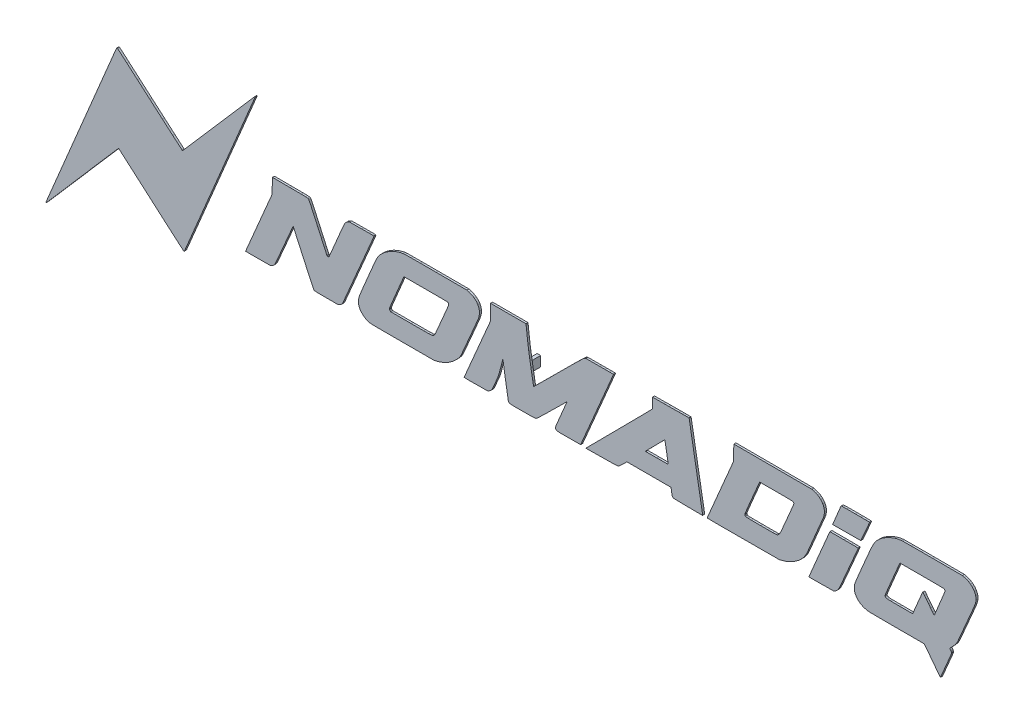
from build123d import *

# Parameters (mm, degrees)
Y_KSEKLIK_EKSTR_ZYON1_DEPTH   = 0.2
Y_KSEKLIK_EKSTR_ZYON1_2_DEPTH = 0.2
Y_KSEKLIK_EKSTR_ZYON1_3_DEPTH = 0.2
Y_KSEKLIK_EKSTR_ZYON1_4_DEPTH = 0.2
Y_KSEKLIK_EKSTR_ZYON1_5_DEPTH = 0.2
Y_KSEKLIK_EKSTR_ZYON1_6_DEPTH = 0.2
Y_KSEKLIK_EKSTR_ZYON1_7_DEPTH = 0.2
Y_KSEKLIK_EKSTR_ZYON1_8_DEPTH = 0.2
Y_KSEKLIK_EKSTR_ZYON1_9_DEPTH = 0.2
SKETCH4_W                     = 0.347706158
SKETCH4_H                     = 0.98459693
BOSS_EXTRUDE2_DEPTH           = 1


with BuildPart() as part:
    # Çizim1 → Yükseklik-Ekstrüzyon1 (new body)
    with BuildSketch(Plane.XY):
        with BuildLine():
            Line((-30.51702252, 5.640207004), (-31.881612062, 4.06777004))
            Line((-31.881612062, 4.06777004), (-33.036250842, 2.743929182))
            Line((-33.036250842, 2.743929182), (-34.080710724, 1.55031139))
            ThreePointArc((-34.080710724, 1.55031139), (-34.091671992, 1.542168784), (-34.10501822, 1.539282674))
            ThreePointArc((-34.10501822, 1.539282674), (-34.118726717, 1.541740246), (-34.130727781, 1.54880686))
            Line((-34.130727781, 1.54880686), (-35.069522655, 2.355004396))
            Line((-35.069522655, 2.355004396), (-36.109605746, 3.251459149))
            Line((-36.109605746, 3.251459149), (-37.338076284, 4.316207648))
            Line((-37.338076284, 4.316207648), (-38.566568336, 5.381941386))
            Line((-38.566568336, 5.381941386), (-39.606822395, 6.281527372))
            Line((-39.606822395, 6.281527372), (-40.544864829, 7.091037097))
            ThreePointArc((-40.544864829, 7.091037097), (-40.557629792, 7.100257414), (-40.571789719, 7.10714617))
            ThreePointArc((-40.571789719, 7.10714617), (-40.5829683, 7.1080489), (-40.592857954, 7.102760201))
            ThreePointArc((-40.592857954, 7.102760201), (-40.60694744, 7.08733319), (-40.619299402, 7.070482809))
            ThreePointArc((-40.619299402, 7.070482809), (-40.636141797, 7.042669784), (-40.651039165, 7.013768244))
            Line((-40.651039165, 7.013768244), (-40.690212238, 6.925912289))
            Line((-40.690212238, 6.925912289), (-42.278492498, 3.135697829))
            Line((-42.278492498, 3.135697829), (-44.770546021, -2.819218747))
            Line((-44.770546021, -2.819218747), (-47.603447582, -9.590605835))
            ThreePointArc((-47.603447582, -9.590605835), (-47.612762095, -9.614842221), (-47.620640209, -9.639582833))
            ThreePointArc((-47.620640209, -9.639582833), (-47.622682953, -9.648464643), (-47.623776393, -9.657512502))
            ThreePointArc((-47.623776393, -9.657512502), (-47.623612418, -9.665158958), (-47.622099978, -9.672656138))
            ThreePointArc((-47.622099978, -9.672656138), (-47.619722824, -9.678038864), (-47.616060206, -9.682644277))
            ThreePointArc((-47.616060206, -9.682644277), (-47.611784824, -9.685434425), (-47.606774081, -9.686412311))
            ThreePointArc((-47.606774081, -9.686412311), (-47.596603781, -9.684206995), (-47.588260373, -9.67798719))
            Line((-47.588260373, -9.67798719), (-46.540995922, -8.475870292))
            Line((-46.540995922, -8.475870292), (-45.384897882, -7.145566779))
            Line((-45.384897882, -7.145566779), (-44.016900278, -5.565418205))
            Line((-44.016900278, -5.565418205), (-42.649292697, -3.985259408))
            Line((-42.649292697, -3.985259408), (-41.494434005, -2.654966117))
            Line((-41.494434005, -2.654966117), (-40.447338079, -1.451149909))
            ThreePointArc((-40.447338079, -1.451149909), (-40.440685567, -1.446184753), (-40.432573306, -1.444424098))
            ThreePointArc((-40.432573306, -1.444424098), (-40.424232802, -1.445927767), (-40.416942521, -1.450249436))
            Line((-40.416942521, -1.450249436), (-39.470783162, -2.269237563))
            Line((-39.470783162, -2.269237563), (-38.425880059, -3.175657308))
            Line((-38.425880059, -3.175657308), (-37.188912139, -4.252299692))
            Line((-37.188912139, -4.252299692), (-35.600632388, -5.633848971))
            Line((-35.600632388, -5.633848971), (-34.660662613, -6.443124897))
            Line((-34.660662613, -6.443124897), (-33.971740802, -7.030480392))
            ThreePointArc((-33.971740802, -7.030480392), (-33.954050802, -7.036456708), (-33.937103258, -7.028618774))
            ThreePointArc((-33.937103258, -7.028618774), (-33.918071544, -7.004488567), (-33.903683781, -6.977332255))
            Line((-33.903683781, -6.977332255), (-30.415719601, 1.344084322))
            Line((-30.415719601, 1.344084322), (-26.926800707, 9.667966428))
            ThreePointArc((-26.926800707, 9.667966428), (-26.918578965, 9.694765841), (-26.915802041, 9.722660181))
            ThreePointArc((-26.915802041, 9.722660181), (-26.916283105, 9.726306898), (-26.91769339, 9.729704111))
            ThreePointArc((-26.91769339, 9.729704111), (-26.920050789, 9.732972259), (-26.923011854, 9.735705429))
            ThreePointArc((-26.923011854, 9.735705429), (-26.926812118, 9.738074074), (-26.930967674, 9.739742558))
            ThreePointArc((-26.930967674, 9.739742558), (-26.935605763, 9.740782255), (-26.94034612, 9.741131333))
            ThreePointArc((-26.94034612, 9.741131333), (-26.949504077, 9.739146935), (-26.957019216, 9.733549729))
            Line((-26.957019216, 9.733549729), (-28.001119252, 8.536484825))
            Line((-28.001119252, 8.536484825), (-29.153229053, 7.212664813))
            ThreePointArc((-29.153229053, 7.212664813), (-29.83537738, 6.426654115), (-30.51702252, 5.640207004))
        make_face()
    extrude(amount=Y_KSEKLIK_EKSTR_ZYON1_DEPTH)


with BuildPart() as body_2:
    # Çizim1 → Y_kseklik-Ekstr_zyon1 2 (new body)
    with BuildSketch(Plane.XY):
        with BuildLine():
            Line((34.002103981, 1.26593393), (33.401469652, -0.133194787))
            Line((33.401469652, -0.133194787), (33.068356265, -0.919046179))
            Line((33.068356265, -0.919046179), (32.780541835, -1.607236246))
            Line((32.780541835, -1.607236246), (32.536345399, -2.197879118))
            ThreePointArc((32.536345399, -2.197879118), (32.514730918, -2.255375588), (32.496752038, -2.314110499))
            ThreePointArc((32.496752038, -2.314110499), (32.475048302, -2.409792708), (32.46158888, -2.506978001))
            ThreePointArc((32.46158888, -2.506978001), (32.454335387, -2.617789021), (32.453635549, -2.728834983))
            ThreePointArc((32.453635549, -2.728834983), (32.45934273, -2.836087206), (32.471456413, -2.942805855))
            ThreePointArc((32.471456413, -2.942805855), (32.488615064, -3.027655366), (32.51524417, -3.110024958))
            ThreePointArc((32.51524417, -3.110024958), (32.598015349, -3.282399035), (32.706692791, -3.439730229))
            ThreePointArc((32.706692791, -3.439730229), (32.842536088, -3.584713762), (32.997270695, -3.709336501))
            ThreePointArc((32.997270695, -3.709336501), (33.178362317, -3.818649104), (33.37209352, -3.903570487))
            ThreePointArc((33.37209352, -3.903570487), (33.588460467, -3.96929215), (33.810587122, -4.011644735))
            ThreePointArc((33.810587122, -4.011644735), (33.899556978, -4.020972591), (33.988931573, -4.024823021))
            Line((33.988931573, -4.024823021), (34.653961876, -4.033038109))
            Line((34.653961876, -4.033038109), (35.528034198, -4.038897814))
            Line((35.528034198, -4.038897814), (36.700634893, -4.040997916))
            Line((36.700634893, -4.040997916), (39.381358713, -4.041881013))
            Line((39.381358713, -4.041881013), (40.168688525, -5.072515387))
            Line((40.168688525, -5.072515387), (40.471672307, -5.468355282))
            Line((40.471672307, -5.468355282), (40.729308349, -5.803224159))
            Line((40.729308349, -5.803224159), (40.960764599, -6.103025222))
            ThreePointArc((40.960764599, -6.103025222), (40.965728178, -6.108380079), (40.971569444, -6.112760857))
            ThreePointArc((40.971569444, -6.112760857), (40.980536493, -6.113867821), (40.987216734, -6.107784423))
            Line((40.987216734, -6.107784423), (41.525271591, -4.840033091))
            Line((41.525271591, -4.840033091), (42.037991789, -3.629832767))
            ThreePointArc((42.037991789, -3.629832767), (42.066806791, -3.554217315), (42.090091671, -3.476720121))
            ThreePointArc((42.090091671, -3.476720121), (42.091866692, -3.462041134), (42.089649173, -3.447422448))
            ThreePointArc((42.089649173, -3.447422448), (42.082221169, -3.425230658), (42.073172234, -3.403649008))
            ThreePointArc((42.073172234, -3.403649008), (42.059673501, -3.37676729), (42.044517758, -3.350783718))
            ThreePointArc((42.044517758, -3.350783718), (42.024882825, -3.320672342), (42.004149576, -3.291306409))
            Line((42.004149576, -3.291306409), (41.905031553, -3.15628061))
            Line((41.905031553, -3.15628061), (42.181877984, -2.866363537))
            ThreePointArc((42.181877984, -2.866363537), (42.242781131, -2.801216626), (42.302290033, -2.734793709))
            ThreePointArc((42.302290033, -2.734793709), (42.360432004, -2.667065558), (42.417129509, -2.598123669))
            ThreePointArc((42.417129509, -2.598123669), (42.467223313, -2.534442912), (42.515886055, -2.469662007))
            ThreePointArc((42.515886055, -2.469662007), (42.552003637, -2.417967566), (42.585675224, -2.364647597))
            ThreePointArc((42.585675224, -2.364647597), (42.664459092, -2.222753419), (42.733677151, -2.075955204))
            Line((42.733677151, -2.075955204), (43.510626934, -0.275958767))
            Line((43.510626934, -0.275958767), (44.264704846, 1.481742999))
            ThreePointArc((44.264704846, 1.481742999), (44.350931551, 1.69607884), (44.42787815, 1.913918501))
            ThreePointArc((44.42787815, 1.913918501), (44.474668475, 2.09316749), (44.498658632, 2.276862908))
            ThreePointArc((44.498658632, 2.276862908), (44.497009246, 2.450071361), (44.468931065, 2.620996797))
            ThreePointArc((44.468931065, 2.620996797), (44.4148335, 2.786765265), (44.33626524, 2.942434016))
            ThreePointArc((44.33626524, 2.942434016), (44.229301586, 3.097540689), (44.104447039, 3.238645774))
            ThreePointArc((44.104447039, 3.238645774), (44.029864114, 3.308427548), (43.950719161, 3.372989031))
            ThreePointArc((43.950719161, 3.372989031), (43.869333945, 3.430315276), (43.783968138, 3.481525928))
            ThreePointArc((43.783968138, 3.481525928), (43.689784399, 3.529322011), (43.592564606, 3.570593723))
            ThreePointArc((43.592564606, 3.570593723), (43.479323979, 3.611196818), (43.364327949, 3.646523356))
            Line((43.364327949, 3.646523356), (43.154477618, 3.705717052))
            Line((43.154477618, 3.705717052), (40.210910399, 3.709983164))
            Line((40.210910399, 3.709983164), (39.068321673, 3.709918807))
            Line((39.068321673, 3.709918807), (38.073061083, 3.706102713))
            Line((38.073061083, 3.706102713), (37.218259588, 3.700145881))
            ThreePointArc((37.218259588, 3.700145881), (37.142324383, 3.697538292), (37.066645419, 3.690781867))
            ThreePointArc((37.066645419, 3.690781867), (36.748045846, 3.637240098), (36.436400062, 3.552097196))
            ThreePointArc((36.436400062, 3.552097196), (36.105836544, 3.429413364), (35.785714306, 3.281611761))
            ThreePointArc((35.785714306, 3.281611761), (35.477485507, 3.109336623), (35.183436904, 2.913839475))
            ThreePointArc((35.183436904, 2.913839475), (34.930019667, 2.711059171), (34.69791904, 2.484190383))
            ThreePointArc((34.69791904, 2.484190383), (34.579233333, 2.345083525), (34.472303979, 2.19674901))
            ThreePointArc((34.472303979, 2.19674901), (34.366932693, 2.025944773), (34.272331054, 1.848948374))
            ThreePointArc((34.272331054, 1.848948374), (34.133445435, 1.559189511), (34.002103981, 1.26593393))
        make_face()
        with BuildLine():
            Line((41.408932632, 1.420979396), (40.91452838, 0.216535294))
            Line((40.91452838, 0.216535294), (40.420055007, -0.983846467))
            ThreePointArc((40.420055007, -0.983846467), (40.394632125, -1.032636029), (40.36097483, -1.076155344))
            ThreePointArc((40.36097483, -1.076155344), (40.353893848, -1.079121384), (40.347004716, -1.075733531))
            Line((40.347004716, -1.075733531), (40.188024724, -0.881888373))
            Line((40.188024724, -0.881888373), (40.008118257, -0.657479184))
            Line((40.008118257, -0.657479184), (39.797898801, -0.387093027))
            Line((39.797898801, -0.387093027), (39.587724356, -0.115332545))
            Line((39.587724356, -0.115332545), (39.407830653, 0.113502565))
            Line((39.407830653, 0.113502565), (39.246786084, 0.316042494))
            ThreePointArc((39.246786084, 0.316042494), (39.241550776, 0.320222793), (39.235019549, 0.321714909))
            ThreePointArc((39.235019549, 0.321714909), (39.228900127, 0.31988751), (39.224784801, 0.315003783))
            Line((39.224784801, 0.315003783), (39.077385422, -0.02410947))
            Line((39.077385422, -0.02410947), (38.914183191, -0.404157207))
            Line((38.914183191, -0.404157207), (38.723806616, -0.855559582))
            Line((38.723806616, -0.855559582), (38.230691459, -2.0328341))
            Line((38.230691459, -2.0328341), (36.946225763, -2.032592005))
            Line((36.946225763, -2.032592005), (36.026738721, -2.029967306))
            ThreePointArc((36.026738721, -2.029967306), (35.875481064, -2.025703145), (35.724571992, -2.014589469))
            ThreePointArc((35.724571992, -2.014589469), (35.649544634, -2.000929952), (35.577853042, -1.974929904))
            ThreePointArc((35.577853042, -1.974929904), (35.532477481, -1.941704962), (35.503641511, -1.893421163))
            ThreePointArc((35.503641511, -1.893421163), (35.495867211, -1.846409501), (35.504617437, -1.79956967))
            ThreePointArc((35.504617437, -1.79956967), (35.569300493, -1.630500251), (35.636155399, -1.462277817))
            Line((35.636155399, -1.462277817), (35.891488635, -0.845567436))
            Line((35.891488635, -0.845567436), (36.712056433, 1.091061579))
            Line((36.712056433, 1.091061579), (36.964632723, 1.686464948))
            Line((36.964632723, 1.686464948), (39.137080729, 1.686464948))
            Line((39.137080729, 1.686464948), (40.393285557, 1.685244626))
            Line((40.393285557, 1.685244626), (40.954397599, 1.679463593))
            Line((40.954397599, 1.679463593), (41.291963335, 1.67025887))
            ThreePointArc((41.291963335, 1.67025887), (41.332353577, 1.663192525), (41.369002218, 1.644802802))
            ThreePointArc((41.369002218, 1.644802802), (41.382729515, 1.633866704), (41.39500652, 1.621324294))
            ThreePointArc((41.39500652, 1.621324294), (41.405282108, 1.607693996), (41.413643556, 1.592812501))
            ThreePointArc((41.413643556, 1.592812501), (41.420269677, 1.576286022), (41.4247472, 1.559052862))
            ThreePointArc((41.4247472, 1.559052862), (41.427541535, 1.539642723), (41.428475816, 1.520054744))
            ThreePointArc((41.428475816, 1.520054744), (41.423543396, 1.469562516), (41.408932632, 1.420979396))
        make_face(mode=Mode.SUBTRACT)
    extrude(amount=Y_KSEKLIK_EKSTR_ZYON1_2_DEPTH)


with BuildPart() as body_3:
    # Çizim1 → Y_kseklik-Ekstr_zyon1 3 (new body)
    with BuildSketch(Plane.XY):
        with BuildLine():
            Line((-25.211224785, 2.950808873), (-25.227873842, 2.206347809))
            Line((-25.227873842, 2.206347809), (-26.529654081, -0.856672391))
            Line((-26.529654081, -0.856672391), (-27.029758258, -2.03354637))
            Line((-27.029758258, -2.03354637), (-27.453071642, -3.030058673))
            Line((-27.453071642, -3.030058673), (-27.833703249, -3.926302131))
            Line((-27.833703249, -3.926302131), (-27.845171441, -3.954171772))
            ThreePointArc((-27.845171441, -3.954171772), (-27.843842865, -3.967312442), (-27.83231739, -3.973762693))
            Line((-27.83231739, -3.973762693), (-27.614904594, -3.980356068))
            Line((-27.614904594, -3.980356068), (-27.278222587, -3.983689979))
            Line((-27.278222587, -3.983689979), (-26.631394189, -3.980931963))
            Line((-26.631394189, -3.980931963), (-25.403879775, -3.973212512))
            Line((-25.403879775, -3.973212512), (-25.250700632, -3.897992354))
            ThreePointArc((-25.250700632, -3.897992354), (-25.217687603, -3.880680333), (-25.185638296, -3.861643313))
            ThreePointArc((-25.185638296, -3.861643313), (-25.150757396, -3.838720203), (-25.11676827, -3.814494484))
            ThreePointArc((-25.11676827, -3.814494484), (-25.085085464, -3.790041552), (-25.054363066, -3.764392375))
            ThreePointArc((-25.054363066, -3.764392375), (-25.031252928, -3.742732785), (-25.009863314, -3.719372548))
            ThreePointArc((-25.009863314, -3.719372548), (-24.972694312, -3.668803102), (-24.942874437, -3.613580113))
            Line((-24.942874437, -3.613580113), (-24.735598075, -3.156531823))
            Line((-24.735598075, -3.156531823), (-24.453957617, -2.517394056))
            Line((-24.453957617, -2.517394056), (-24.039131152, -1.554161376))
            Line((-24.039131152, -1.554161376), (-23.699391394, -0.763531183))
            Line((-23.699391394, -0.763531183), (-23.410821404, -0.09780246))
            Line((-23.410821404, -0.09780246), (-23.149294716, 0.502140639))
            ThreePointArc((-23.149294716, 0.502140639), (-23.145665955, 0.506536134), (-23.140260373, 0.508343886))
            ThreePointArc((-23.140260373, 0.508343886), (-23.134825907, 0.506946553), (-23.131091279, 0.502758652))
            Line((-23.131091279, 0.502758652), (-22.835810828, -0.136341435))
            Line((-22.835810828, -0.136341435), (-22.51000193, -0.845183811))
            Line((-22.51000193, -0.845183811), (-22.126024477, -1.687301169))
            Line((-22.126024477, -1.687301169), (-21.620113231, -2.795615239))
            Line((-21.620113231, -2.795615239), (-21.322786771, -3.432082174))
            Line((-21.322786771, -3.432082174), (-21.11385138, -3.866353122))
            ThreePointArc((-21.11385138, -3.866353122), (-21.090737802, -3.90108777), (-21.059220458, -3.928426211))
            ThreePointArc((-21.059220458, -3.928426211), (-21.023863025, -3.945901297), (-20.985349445, -3.954400168))
            ThreePointArc((-20.985349445, -3.954400168), (-20.899319004, -3.961416502), (-20.813117741, -3.965867101))
            ThreePointArc((-20.813117741, -3.965867101), (-20.663197966, -3.970135482), (-20.513228263, -3.971937272))
            Line((-20.513228263, -3.971937272), (-19.839021238, -3.973214245))
            Line((-19.839021238, -3.973214245), (-18.687190754, -3.973214245))
            Line((-18.687190754, -3.973214245), (-18.517445616, -3.881186024))
            ThreePointArc((-18.517445616, -3.881186024), (-18.482303458, -3.861238906), (-18.44796421, -3.839939262))
            ThreePointArc((-18.44796421, -3.839939262), (-18.41333894, -3.816639004), (-18.379558411, -3.792130084))
            ThreePointArc((-18.379558411, -3.792130084), (-18.350067102, -3.769084074), (-18.32142443, -3.744991477))
            ThreePointArc((-18.32142443, -3.744991477), (-18.302919485, -3.727044384), (-18.286407888, -3.707247961))
            ThreePointArc((-18.286407888, -3.707247961), (-18.252048136, -3.65510512), (-18.224151108, -3.599237201))
            Line((-18.224151108, -3.599237201), (-16.713731049, -0.059918911))
            Line((-16.713731049, -0.059918911), (-15.222493404, 3.436166873))
            ThreePointArc((-15.222493404, 3.436166873), (-15.181801611, 3.540930402), (-15.148018691, 3.648121508))
            ThreePointArc((-15.148018691, 3.648121508), (-15.151158888, 3.667669436), (-15.168063421, 3.677975702))
            ThreePointArc((-15.168063421, 3.677975702), (-15.238167294, 3.684653858), (-15.308486134, 3.688450118))
            ThreePointArc((-15.308486134, 3.688450118), (-15.449595441, 3.691794732), (-15.590743095, 3.692397122))
            Line((-15.590743095, 3.692397122), (-16.348890724, 3.688267249))
            Line((-16.348890724, 3.688267249), (-17.563283304, 3.680066712))
            Line((-17.563283304, 3.680066712), (-17.695506951, 3.614506057))
            ThreePointArc((-17.695506951, 3.614506057), (-17.802334593, 3.550033382), (-17.89708974, 3.468852518))
            ThreePointArc((-17.89708974, 3.468852518), (-17.981687679, 3.369816632), (-18.051028752, 3.259559055))
            ThreePointArc((-18.051028752, 3.259559055), (-18.153011486, 3.057283908), (-18.246144045, 2.850784419))
            Line((-18.246144045, 2.850784419), (-18.805874805, 1.52590103))
            Line((-18.805874805, 1.52590103), (-19.098449411, 0.831007738))
            Line((-19.098449411, 0.831007738), (-19.349111607, 0.240390047))
            Line((-19.349111607, 0.240390047), (-19.573236314, -0.284773761))
            ThreePointArc((-19.573236314, -0.284773761), (-19.580906662, -0.299875069), (-19.590508016, -0.313828482))
            ThreePointArc((-19.590508016, -0.313828482), (-19.597563454, -0.321059745), (-19.605960459, -0.326677634))
            ThreePointArc((-19.605960459, -0.326677634), (-19.618425121, -0.33259943), (-19.631343535, -0.337452268))
            ThreePointArc((-19.631343535, -0.337452268), (-19.646310856, -0.34172327), (-19.661567254, -0.344806209))
            ThreePointArc((-19.661567254, -0.344806209), (-19.676924497, -0.346659137), (-19.692380729, -0.347278109))
            ThreePointArc((-19.692380729, -0.347278109), (-19.707631947, -0.346658834), (-19.722782748, -0.344805085))
            ThreePointArc((-19.722782748, -0.344805085), (-19.737441352, -0.341752399), (-19.751783682, -0.337452268))
            ThreePointArc((-19.751783682, -0.337452268), (-19.763833164, -0.332620652), (-19.775375089, -0.326677715))
            ThreePointArc((-19.775375089, -0.326677715), (-19.782823658, -0.321072837), (-19.788690101, -0.313828482))
            ThreePointArc((-19.788690101, -0.313828482), (-19.796630266, -0.300140237), (-19.803663618, -0.285964687))
            Line((-19.803663618, -0.285964687), (-20.059785204, 0.275398962))
            Line((-20.059785204, 0.275398962), (-20.346168765, 0.904480674))
            Line((-20.346168765, 0.904480674), (-20.682237627, 1.645080393))
            Line((-20.682237627, 1.645080393), (-21.125146527, 2.61767739))
            Line((-21.125146527, 2.61767739), (-21.387348416, 3.17841972))
            Line((-21.387348416, 3.17841972), (-21.570183946, 3.555457177))
            ThreePointArc((-21.570183946, 3.555457177), (-21.595062868, 3.593817601), (-21.628220762, 3.62529834))
            ThreePointArc((-21.628220762, 3.62529834), (-21.66998415, 3.648475335), (-21.716412578, 3.659689374))
            ThreePointArc((-21.716412578, 3.659689374), (-21.819651831, 3.668505866), (-21.923130902, 3.673812074))
            ThreePointArc((-21.923130902, 3.673812074), (-22.124276987, 3.679245381), (-22.325480701, 3.681762169))
            Line((-22.325480701, 3.681762169), (-23.448059115, 3.687666328))
            Line((-23.448059115, 3.687666328), (-25.194575701, 3.69526991))
            Line((-25.194575701, 3.69526991), (-25.211224785, 2.950808873))
        make_face()
    extrude(amount=Y_KSEKLIK_EKSTR_ZYON1_3_DEPTH)


with BuildPart() as body_4:
    # Çizim1 → Y_kseklik-Ekstr_zyon1 4 (new body)
    with BuildSketch(Plane.XY):
        with BuildLine():
            Line((-3.581342788, 2.937687788), (-3.581342788, 2.181933006))
            Line((-3.581342788, 2.181933006), (-4.877979733, -0.855499969))
            Line((-4.877979733, -0.855499969), (-5.376389886, -2.023485284))
            Line((-5.376389886, -2.023485284), (-5.798977842, -3.01476082))
            Line((-5.798977842, -3.01476082), (-6.177187776, -3.902529936))
            Line((-6.177187776, -3.902529936), (-6.192483113, -3.940843862))
            ThreePointArc((-6.192483113, -3.940843862), (-6.19070565, -3.959778104), (-6.174757915, -3.97013835))
            ThreePointArc((-6.174757915, -3.97013835), (-6.108607024, -3.976973725), (-6.042214703, -3.980810708))
            ThreePointArc((-6.042214703, -3.980810708), (-5.907118341, -3.984188986), (-5.771981293, -3.984835491))
            Line((-5.771981293, -3.984835491), (-5.049714422, -3.980989702))
            Line((-5.049714422, -3.980989702), (-3.889079328, -3.97321831))
            Line((-3.889079328, -3.97321831), (-3.755280818, -3.902422923))
            ThreePointArc((-3.755280818, -3.902422923), (-3.699406401, -3.871110537), (-3.645107405, -3.837139446))
            ThreePointArc((-3.645107405, -3.837139446), (-3.599819747, -3.804816928), (-3.557023912, -3.769260866))
            ThreePointArc((-3.557023912, -3.769260866), (-3.521239651, -3.734453546), (-3.488472326, -3.696792355))
            ThreePointArc((-3.488472326, -3.696792355), (-3.460868421, -3.65854243), (-3.437163193, -3.617761375))
            Line((-3.437163193, -3.617761375), (-3.409467918, -3.559967109))
            Line((-3.409467918, -3.559967109), (-3.318231303, -3.353000723))
            Line((-3.318231303, -3.353000723), (-3.210920349, -3.107231993))
            Line((-3.210920349, -3.107231993), (-3.091713476, -2.831363443))
            Line((-3.091713476, -2.831363443), (-2.901984085, -2.380888318))
            ThreePointArc((-2.901984085, -2.380888318), (-2.849132695, -2.246303299), (-2.800821012, -2.110022788))
            ThreePointArc((-2.800821012, -2.110022788), (-2.75541317, -1.967498293), (-2.714442326, -1.823635533))
            Line((-2.714442326, -1.823635533), (-2.576637461, -1.297248111))
            Line((-2.576637461, -1.297248111), (-2.364693476, -0.46769735))
            Line((-2.364693476, -0.46769735), (-2.342424293, -0.614875711))
            Line((-2.342424293, -0.614875711), (-2.175886465, -1.688377522))
            Line((-2.175886465, -1.688377522), (-2.001020215, -2.762609366))
            Line((-2.001020215, -2.762609366), (-1.827657004, -3.799629649))
            ThreePointArc((-1.827657004, -3.799629649), (-1.817395198, -3.837107712), (-1.799818726, -3.871762834))
            ThreePointArc((-1.799818726, -3.871762834), (-1.760431233, -3.913931089), (-1.708668946, -3.939430146))
            ThreePointArc((-1.708668946, -3.939430146), (-1.619855191, -3.95992499), (-1.52943784, -3.971441252))
            ThreePointArc((-1.52943784, -3.971441252), (-1.361958109, -3.981086279), (-1.194232166, -3.984325861))
            Line((-1.194232166, -3.984325861), (-0.370178516, -3.981533674))
            Line((-0.370178516, -3.981533674), (0.412079155, -3.974955416))
            ThreePointArc((0.412079155, -3.974955416), (0.547774653, -3.97215356), (0.683377872, -3.966418964))
            ThreePointArc((0.683377872, -3.966418964), (0.758299272, -3.959984356), (0.832642232, -3.948681938))
            ThreePointArc((0.832642232, -3.948681938), (0.888170338, -3.934183881), (0.941046882, -3.911876136))
            ThreePointArc((0.941046882, -3.911876136), (0.992500522, -3.880863438), (1.03902599, -3.842854948))
            Line((1.03902599, -3.842854948), (1.389463403, -3.51226382))
            Line((1.389463403, -3.51226382), (1.858226268, -3.059906204))
            Line((1.858226268, -3.059906204), (2.519872102, -2.409282638))
            Line((2.519872102, -2.409282638), (3.079518863, -1.857025568))
            Line((3.079518863, -1.857025568), (3.55159268, -1.39300024))
            Line((3.55159268, -1.39300024), (3.979388074, -0.973548682))
            ThreePointArc((3.979388074, -0.973548682), (3.981752203, -0.972565078), (3.984141133, -0.973486813))
            ThreePointArc((3.984141133, -0.973486813), (3.985534003, -0.975937947), (3.985273983, -0.978745176))
            Line((3.985273983, -0.978745176), (3.822937263, -1.366031839))
            Line((3.822937263, -1.366031839), (3.64253716, -1.794380169))
            Line((3.64253716, -1.794380169), (3.427125626, -2.30214522))
            Line((3.427125626, -2.30214522), (3.210345334, -2.815298578))
            Line((3.210345334, -2.815298578), (3.02532177, -3.261124231))
            Line((3.02532177, -3.261124231), (2.867303964, -3.647433203))
            ThreePointArc((2.867303964, -3.647433203), (2.856866474, -3.677566958), (2.849710985, -3.708644014))
            ThreePointArc((2.849710985, -3.708644014), (2.845973777, -3.745525407), (2.847549657, -3.782562152))
            ThreePointArc((2.847549657, -3.782562152), (2.854536895, -3.815872144), (2.867531368, -3.847328792))
            ThreePointArc((2.867531368, -3.847328792), (2.886447157, -3.876601018), (2.910271107, -3.902038976))
            ThreePointArc((2.910271107, -3.902038976), (2.941141306, -3.926286718), (2.97480815, -3.946472498))
            ThreePointArc((2.97480815, -3.946472498), (3.013686618, -3.961838711), (3.054855409, -3.969104141))
            ThreePointArc((3.054855409, -3.969104141), (3.149011305, -3.974975016), (3.243277696, -3.978669236))
            ThreePointArc((3.243277696, -3.978669236), (3.400427041, -3.981853612), (3.557606227, -3.982725472))
            Line((3.557606227, -3.982725472), (4.195740639, -3.980199115))
            Line((4.195740639, -3.980199115), (5.337959412, -3.973221282))
            Line((5.337959412, -3.973221282), (6.966141947, -0.151542952))
            Line((6.966141947, -0.151542952), (7.590452564, 1.31477638))
            Line((7.590452564, 1.31477638), (8.116045838, 2.551335091))
            Line((8.116045838, 2.551335091), (8.592238508, 3.672881405))
            ThreePointArc((8.592238508, 3.672881405), (8.593797679, 3.677901592), (8.594324454, 3.68313187))
            ThreePointArc((8.594324454, 3.68313187), (8.592776351, 3.686879381), (8.58903474, 3.688441694))
            Line((8.58903474, 3.688441694), (8.19146549, 3.68994968))
            Line((8.19146549, 3.68994968), (7.748767457, 3.690239006))
            Line((7.748767457, 3.690239006), (7.222889727, 3.688090951))
            Line((7.222889727, 3.688090951), (5.851455, 3.680053487))
            Line((5.851455, 3.680053487), (5.71765649, 3.615824288))
            ThreePointArc((5.71765649, 3.615824288), (5.650411941, 3.576670019), (5.590236811, 3.527336057))
            Line((5.590236811, 3.527336057), (5.118193952, 3.072857184))
            Line((5.118193952, 3.072857184), (4.407638634, 2.374674269))
            Line((4.407638634, 2.374674269), (3.128651934, 1.100755241))
            Line((3.128651934, 1.100755241), (2.187151745, 0.162855195))
            Line((2.187151745, 0.162855195), (1.394665044, -0.622263838))
            Line((1.394665044, -0.622263838), (0.681246947, -1.326491717))
            ThreePointArc((0.681246947, -1.326491717), (0.676262866, -1.327457611), (0.673449277, -1.32323177))
            ThreePointArc((0.673449277, -1.32323177), (0.67299094, -1.312469272), (0.67161927, -1.301784706))
            Line((0.67161927, -1.301784706), (0.598422887, -0.875986487))
            Line((0.598422887, -0.875986487), (0.515960564, -0.399306737))
            Line((0.515960564, -0.399306737), (0.418040258, 0.161592244))
            Line((0.418040258, 0.161592244), (0.291188032, 0.903058978))
            Line((0.291188032, 0.903058978), (0.196068557, 1.500503631))
            Line((0.196068557, 1.500503631), (0.121258385, 2.026138864))
            Line((0.121258385, 2.026138864), (0.057410592, 2.542769672))
            Line((0.057410592, 2.542769672), (0.015963453, 2.90471522))
            Line((0.015963453, 2.90471522), (-0.021497427, 3.228194365))
            Line((-0.021497427, 3.228194365), (-0.053395607, 3.500805617))
            Line((-0.053395607, 3.500805617), (-0.063455837, 3.579708124))
            Line((-0.063455837, 3.579708124), (-0.079101673, 3.693436857))
            Line((-0.079101673, 3.693436857), (-1.830222506, 3.693436857))
            Line((-1.830222506, 3.693436857), (-3.581342788, 3.693436857))
            Line((-3.581342788, 3.693436857), (-3.581342788, 2.937687788))
        make_face()
    extrude(amount=Y_KSEKLIK_EKSTR_ZYON1_4_DEPTH)

    # Sketch4 → Boss-Extrude2 (add)
    with BuildSketch(Plane(origin=(0, 0, 0), x_dir=(-1, 0, 0), z_dir=(0, 0, -1))):
        Rectangle(SKETCH4_W, SKETCH4_H)
    extrude(amount=BOSS_EXTRUDE2_DEPTH)


with BuildPart() as body_5:
    # Çizim1 → Y_kseklik-Ekstr_zyon1 5 (new body)
    with BuildSketch(Plane.XY):
        with BuildLine():
            Line((13.591695964, 3.673380528), (12.447718704, 3.666108284))
            Line((12.447718704, 3.666108284), (12.447718704, 3.155410932))
            Line((12.447718704, 3.155410932), (12.447718704, 2.64471358))
            Line((12.447718704, 2.64471358), (11.972733993, 2.155333862))
            Line((11.972733993, 2.155333862), (11.660281424, 1.836288425))
            Line((11.660281424, 1.836288425), (10.807976166, 0.974355882))
            Line((10.807976166, 0.974355882), (9.790523593, -0.052936313))
            Line((9.790523593, -0.052936313), (8.674600723, -1.17780265))
            Line((8.674600723, -1.17780265), (5.851452163, -4.021559472))
            Line((5.851452163, -4.021559472), (7.400482951, -4.003709787))
            Line((7.400482951, -4.003709787), (8.366956846, -3.991388577))
            ThreePointArc((8.366956846, -3.991388577), (8.555267482, -3.987403622), (8.743501416, -3.980713195))
            ThreePointArc((8.743501416, -3.980713195), (8.847707326, -3.974437186), (8.951630966, -3.964530774))
            ThreePointArc((8.951630966, -3.964530774), (9.012300957, -3.95295854), (9.070519291, -3.932333554))
            ThreePointArc((9.070519291, -3.932333554), (9.108676622, -3.912748433), (9.144323299, -3.888897366))
            ThreePointArc((9.144323299, -3.888897366), (9.198666305, -3.846504519), (9.251707467, -3.802493714))
            ThreePointArc((9.251707467, -3.802493714), (9.320097967, -3.74248067), (9.386959109, -3.680768325))
            Line((9.386959109, -3.680768325), (9.554919536, -3.517924085))
            Line((9.554919536, -3.517924085), (9.918314229, -3.157041112))
            Line((9.918314229, -3.157041112), (12.103479168, -3.157041112))
            Line((12.103479168, -3.157041112), (14.288644106, -3.157041112))
            Line((14.288644106, -3.157041112), (14.319315836, -3.3376691))
            Line((14.319315836, -3.3376691), (14.333123494, -3.419007141))
            Line((14.333123494, -3.419007141), (14.34933099, -3.514526888))
            Line((14.34933099, -3.514526888), (14.365325959, -3.608828211))
            Line((14.365325959, -3.608828211), (14.378424191, -3.686090321))
            ThreePointArc((14.378424191, -3.686090321), (14.38496437, -3.720539801), (14.39285899, -3.754704338))
            ThreePointArc((14.39285899, -3.754704338), (14.402111767, -3.788606903), (14.412686511, -3.822120671))
            ThreePointArc((14.412686511, -3.822120671), (14.423089822, -3.851055711), (14.434635942, -3.879554002))
            ThreePointArc((14.434635942, -3.879554002), (14.443710759, -3.897257414), (14.455129511, -3.913547754))
            Line((14.455129511, -3.913547754), (14.503398208, -3.973212023))
            Line((14.503398208, -3.973212023), (15.951798842, -3.996773806))
            Line((15.951798842, -3.996773806), (16.508385069, -4.004548196))
            Line((16.508385069, -4.004548196), (16.979872152, -4.008273949))
            Line((16.979872152, -4.008273949), (17.400693781, -4.009846857))
            ThreePointArc((17.400693781, -4.009846857), (17.409896429, -4.008040294), (17.417698554, -4.002836519))
            ThreePointArc((17.417698554, -4.002836519), (17.425884203, -3.989352189), (17.426924001, -3.973612086))
            Line((17.426924001, -3.973612086), (16.759811494, -0.174981033))
            Line((16.759811494, -0.174981033), (16.096046881, 3.603415005))
            ThreePointArc((16.096046881, 3.603415005), (16.086078489, 3.639653057), (16.069478939, 3.673372787))
            ThreePointArc((16.069478939, 3.673372787), (16.063459353, 3.679206411), (16.055383791, 3.681454052))
            Line((16.055383791, 3.681454052), (15.866662903, 3.685668583))
            Line((15.866662903, 3.685668583), (15.650595757, 3.688053729))
            Line((15.650595757, 3.688053729), (15.396396571, 3.687047671))
            Line((15.396396571, 3.687047671), (15.064684295, 3.684093534))
            Line((15.064684295, 3.684093534), (14.593717393, 3.680395048))
            Line((14.593717393, 3.680395048), (14.078109662, 3.67663341))
            ThreePointArc((14.078109662, 3.67663341), (13.834903081, 3.67496684), (13.591695964, 3.673380528))
        make_face()
        with BuildLine():
            Line((13.853552226, -0.354999481), (13.915636046, -0.717684158))
            Line((13.915636046, -0.717684158), (13.966243406, -1.026353628))
            Line((13.966243406, -1.026353628), (14.009776357, -1.300406533))
            ThreePointArc((14.009776357, -1.300406533), (14.009759396, -1.309078736), (14.007034075, -1.317311599))
            ThreePointArc((14.007034075, -1.317311599), (13.995308672, -1.329872078), (13.978770455, -1.334534486))
            Line((13.978770455, -1.334534486), (12.888343957, -1.337035454))
            Line((12.888343957, -1.337035454), (11.795917416, -1.338965257))
            ThreePointArc((11.795917416, -1.338965257), (11.783762948, -1.333946919), (11.778726154, -1.321800086))
            ThreePointArc((11.778726154, -1.321800086), (11.78239682, -1.303189638), (11.792858996, -1.287366699))
            Line((11.792858996, -1.287366699), (12.722639693, -0.345511936))
            Line((12.722639693, -0.345511936), (13.656683907, 0.60013871))
            ThreePointArc((13.656683907, 0.60013871), (13.666680675, 0.604332847), (13.676702679, 0.600199374))
            ThreePointArc((13.676702679, 0.600199374), (13.68091864, 0.594476389), (13.683248558, 0.587760858))
            Line((13.683248558, 0.587760858), (13.733996809, 0.314265162))
            Line((13.733996809, 0.314265162), (13.78978383, 0.007183104))
            ThreePointArc((13.78978383, 0.007183104), (13.821854914, -0.173875284), (13.853552226, -0.354999481))
        make_face(mode=Mode.SUBTRACT)
    extrude(amount=Y_KSEKLIK_EKSTR_ZYON1_5_DEPTH)


with BuildPart() as body_6:
    # Çizim1 → Y_kseklik-Ekstr_zyon1 6 (new body)
    with BuildSketch(Plane.XY):
        with BuildLine():
            Line((31.112719083, 3.61013533), (31.010052357, 3.365928946))
            Line((31.010052357, 3.365928946), (30.89190953, 3.083300172))
            Line((30.89190953, 3.083300172), (30.756421065, 2.756853028))
            Line((30.756421065, 2.756853028), (30.618808468, 2.424701518))
            Line((30.618808468, 2.424701518), (30.493966831, 2.124125146))
            Line((30.493966831, 2.124125146), (30.388978057, 1.8719529))
            Line((30.388978057, 1.8719529), (30.352849088, 1.786575589))
            Line((30.352849088, 1.786575589), (30.29813762, 1.659228763))
            Line((30.29813762, 1.659228763), (31.693687253, 1.66615693))
            Line((31.693687253, 1.66615693), (33.089236887, 1.673085097))
            Line((33.089236887, 1.673085097), (33.525372371, 2.663194071))
            Line((33.525372371, 2.663194071), (33.69261818, 3.044235877))
            Line((33.69261818, 3.044235877), (33.833541594, 3.368354017))
            Line((33.833541594, 3.368354017), (33.958614301, 3.657906703))
            ThreePointArc((33.958614301, 3.657906703), (33.961055271, 3.665476821), (33.962013505, 3.673372821))
            ThreePointArc((33.962013505, 3.673372821), (33.95977608, 3.679139125), (33.954103599, 3.681604746))
            Line((33.954103599, 3.681604746), (33.549962424, 3.687547091))
            Line((33.549962424, 3.687547091), (33.096884008, 3.692000414))
            Line((33.096884008, 3.692000414), (32.558576316, 3.693442575))
            Line((32.558576316, 3.693442575), (31.697002862, 3.692336462))
            ThreePointArc((31.697002862, 3.692336462), (31.529332623, 3.690639931), (31.361707114, 3.686411918))
            ThreePointArc((31.361707114, 3.686411918), (31.267942718, 3.682232818), (31.174302699, 3.675847407))
            ThreePointArc((31.174302699, 3.675847407), (31.148374476, 3.666927147), (31.129957551, 3.646613096))
            ThreePointArc((31.129957551, 3.646613096), (31.120941637, 3.628561674), (31.112719083, 3.61013533))
        make_face()
    extrude(amount=Y_KSEKLIK_EKSTR_ZYON1_6_DEPTH)


with BuildPart() as body_7:
    # Çizim1 → Y_kseklik-Ekstr_zyon1 7 (new body)
    with BuildSketch(Plane.XY):
        with BuildLine():
            Line((-14.928138507, 1.758356615), (-15.172333555, 1.188149123))
            Line((-15.172333555, 1.188149123), (-15.455645504, 0.523192953))
            Line((-15.455645504, 0.523192953), (-15.778903293, -0.240233595))
            Line((-15.778903293, -0.240233595), (-16.38384481, -1.682932245))
            ThreePointArc((-16.38384481, -1.682932245), (-16.492546721, -1.956725141), (-16.592156754, -2.233955184))
            ThreePointArc((-16.592156754, -2.233955184), (-16.639880175, -2.398482509), (-16.672244795, -2.566706458))
            ThreePointArc((-16.672244795, -2.566706458), (-16.682347813, -2.712050518), (-16.670749998, -2.857282944))
            ThreePointArc((-16.670749998, -2.857282944), (-16.651609527, -2.957214032), (-16.625523774, -3.055560936))
            ThreePointArc((-16.625523774, -3.055560936), (-16.594736036, -3.142100568), (-16.555875522, -3.225328286))
            ThreePointArc((-16.555875522, -3.225328286), (-16.508129664, -3.30679487), (-16.453136516, -3.383555701))
            ThreePointArc((-16.453136516, -3.383555701), (-16.382832864, -3.467556124), (-16.30770931, -3.54727517))
            ThreePointArc((-16.30770931, -3.54727517), (-16.230933159, -3.619602234), (-16.149948825, -3.687184178))
            ThreePointArc((-16.149948825, -3.687184178), (-16.070215782, -3.745140417), (-15.986434442, -3.797072787))
            ThreePointArc((-15.986434442, -3.797072787), (-15.897666117, -3.843510204), (-15.805780202, -3.883425462))
            ThreePointArc((-15.805780202, -3.883425462), (-15.702052685, -3.920894313), (-15.596448981, -3.952693218))
            ThreePointArc((-15.596448981, -3.952693218), (-15.504170827, -3.972241493), (-15.410274322, -3.981232547))
            ThreePointArc((-15.410274322, -3.981232547), (-15.192441959, -3.988355926), (-14.974538656, -3.992809116))
            Line((-14.974538656, -3.992809116), (-14.201239142, -3.998810487))
            Line((-14.201239142, -3.998810487), (-12.291625786, -3.999971725))
            Line((-12.291625786, -3.999971725), (-9.160740653, -3.999971725))
            Line((-9.160740653, -3.999971725), (-8.872671765, -3.924864653))
            ThreePointArc((-8.872671765, -3.924864653), (-8.606556175, -3.846491173), (-8.345876713, -3.751590552))
            ThreePointArc((-8.345876713, -3.751590552), (-8.098720424, -3.64284155), (-7.859526301, -3.517546907))
            ThreePointArc((-7.859526301, -3.517546907), (-7.631219554, -3.377311845), (-7.413061305, -3.221758568))
            ThreePointArc((-7.413061305, -3.221758568), (-7.20326046, -3.0497456), (-7.005274729, -2.864255693))
            ThreePointArc((-7.005274729, -2.864255693), (-6.943134452, -2.80073685), (-6.882342531, -2.735926358))
            ThreePointArc((-6.882342531, -2.735926358), (-6.823660322, -2.670618883), (-6.766414658, -2.604048606))
            ThreePointArc((-6.766414658, -2.604048606), (-6.716231693, -2.542970211), (-6.667473336, -2.480748649))
            ThreePointArc((-6.667473336, -2.480748649), (-6.631508611, -2.431272847), (-6.598016442, -2.380090906))
            ThreePointArc((-6.598016442, -2.380090906), (-6.518184204, -2.239941857), (-6.448961621, -2.094260093))
            Line((-6.448961621, -2.094260093), (-5.65771842, -0.256093023))
            Line((-5.65771842, -0.256093023), (-4.881822359, 1.557288458))
            ThreePointArc((-4.881822359, 1.557288458), (-4.808140235, 1.744589786), (-4.745168429, 1.935758283))
            ThreePointArc((-4.745168429, 1.935758283), (-4.693256619, 2.198883786), (-4.692043383, 2.467078481))
            ThreePointArc((-4.692043383, 2.467078481), (-4.742993679, 2.71676195), (-4.847523627, 2.949165171))
            ThreePointArc((-4.847523627, 2.949165171), (-5.004851933, 3.161040399), (-5.203017731, 3.335320703))
            ThreePointArc((-5.203017731, 3.335320703), (-5.452496019, 3.483692207), (-5.72231033, 3.590714431))
            Line((-5.72231033, 3.590714431), (-5.922816492, 3.652333767))
            Line((-5.922816492, 3.652333767), (-8.98680237, 3.657145349))
            Line((-8.98680237, 3.657145349), (-10.545140075, 3.658095211))
            Line((-10.545140075, 3.658095211), (-11.45529906, 3.65382934))
            Line((-11.45529906, 3.65382934), (-12.05787328, 3.645814408))
            ThreePointArc((-12.05787328, 3.645814408), (-12.155023147, 3.640420694), (-12.251486013, 3.62768867))
            ThreePointArc((-12.251486013, 3.62768867), (-12.661701206, 3.534132793), (-13.059134627, 3.396017327))
            ThreePointArc((-13.059134627, 3.396017327), (-13.450918462, 3.211506012), (-13.822074122, 2.988386144))
            ThreePointArc((-13.822074122, 2.988386144), (-14.15309134, 2.73962069), (-14.456130543, 2.457443632))
            ThreePointArc((-14.456130543, 2.457443632), (-14.690840876, 2.174909448), (-14.880577923, 1.860402917))
            ThreePointArc((-14.880577923, 1.860402917), (-14.905162159, 1.809754459), (-14.928138507, 1.758356615))
        make_face()
        with BuildLine():
            Line((-7.756110428, 1.399852812), (-8.414347746, -0.147091745))
            Line((-8.414347746, -0.147091745), (-9.070799602, -1.683865385))
            ThreePointArc((-9.070799602, -1.683865385), (-9.107801561, -1.753471267), (-9.155939394, -1.815896203))
            ThreePointArc((-9.155939394, -1.815896203), (-9.170350949, -1.830458472), (-9.185857758, -1.843848451))
            ThreePointArc((-9.185857758, -1.843848451), (-9.206925987, -1.860026288), (-9.228571005, -1.875423882))
            ThreePointArc((-9.228571005, -1.875423882), (-9.252038516, -1.890869075), (-9.276045767, -1.905461193))
            ThreePointArc((-9.276045767, -1.905461193), (-9.29838999, -1.917791122), (-9.321298859, -1.92903724))
            ThreePointArc((-9.321298859, -1.92903724), (-9.378817191, -1.949454485), (-9.439086905, -1.95908694))
            ThreePointArc((-9.439086905, -1.95908694), (-9.573890023, -1.966675474), (-9.708826922, -1.971312244))
            Line((-9.708826922, -1.971312244), (-10.196794664, -1.977531707))
            Line((-10.196794664, -1.977531707), (-11.456601454, -1.97902653))
            Line((-11.456601454, -1.97902653), (-13.484865216, -1.979614227))
            Line((-13.484865216, -1.979614227), (-13.553538318, -1.910941125))
            ThreePointArc((-13.553538318, -1.910941125), (-13.570281579, -1.893050252), (-13.585803748, -1.874090232))
            ThreePointArc((-13.585803748, -1.874090232), (-13.59611997, -1.858375217), (-13.604074122, -1.841342378))
            ThreePointArc((-13.604074122, -1.841342378), (-13.608834493, -1.824900555), (-13.610810342, -1.807897888))
            ThreePointArc((-13.610810342, -1.807897888), (-13.610328345, -1.788530215), (-13.607626981, -1.769345801))
            ThreePointArc((-13.607626981, -1.769345801), (-13.597557852, -1.729374762), (-13.583596637, -1.690591314))
            Line((-13.583596637, -1.690591314), (-13.060438526, -0.435457154))
            Line((-13.060438526, -0.435457154), (-12.577804341, 0.716807291))
            Line((-12.577804341, 0.716807291), (-12.224815962, 1.546527629))
            Line((-12.224815962, 1.546527629), (-12.164616533, 1.686464948))
            Line((-12.164616533, 1.686464948), (-10.006330163, 1.686464948))
            Line((-10.006330163, 1.686464948), (-8.75852154, 1.68524385))
            Line((-8.75852154, 1.68524385), (-8.200897759, 1.67946156))
            Line((-8.200897759, 1.67946156), (-7.865541337, 1.670245478))
            ThreePointArc((-7.865541337, 1.670245478), (-7.825186705, 1.663178697), (-7.788570341, 1.644802691))
            ThreePointArc((-7.788570341, 1.644802691), (-7.775640709, 1.634507681), (-7.764070148, 1.622705787))
            ThreePointArc((-7.764070148, 1.622705787), (-7.753813319, 1.60937442), (-7.745176674, 1.594940562))
            ThreePointArc((-7.745176674, 1.594940562), (-7.738293899, 1.579631406), (-7.733242623, 1.563624299))
            ThreePointArc((-7.733242623, 1.563624299), (-7.730220802, 1.547476942), (-7.729227831, 1.531079304))
            ThreePointArc((-7.729227831, 1.531079304), (-7.736077893, 1.464115801), (-7.756110428, 1.399852812))
        make_face(mode=Mode.SUBTRACT)
    extrude(amount=Y_KSEKLIK_EKSTR_ZYON1_7_DEPTH)


with BuildPart() as body_8:
    # Çizim1 → Y_kseklik-Ekstr_zyon1 8 (new body)
    with BuildSketch(Plane.XY):
        with BuildLine():
            Line((20.49534976, 2.90866714), (20.47999119, 2.149435978))
            Line((20.47999119, 2.149435978), (19.189761963, -0.885128196))
            Line((19.189761963, -0.885128196), (18.694149456, -2.051989925))
            Line((18.694149456, -2.051989925), (18.274692251, -3.042238664))
            Line((18.274692251, -3.042238664), (17.899473758, -3.929682195))
            ThreePointArc((17.899473758, -3.929682195), (17.892343883, -3.94821775), (17.886442291, -3.967180164))
            ThreePointArc((17.886442291, -3.967180164), (17.890604776, -3.989176004), (17.910545798, -3.999349444))
            Line((17.910545798, -3.999349444), (18.383931853, -4.006805537))
            Line((18.383931853, -4.006805537), (19.194480202, -4.010767364))
            Line((19.194480202, -4.010767364), (21.455755166, -4.006787073))
            Line((21.455755166, -4.006787073), (25.03815849, -3.998905859))
            Line((25.03815849, -3.998905859), (25.31085243, -3.926648134))
            ThreePointArc((25.31085243, -3.926648134), (25.692255155, -3.806410605), (26.060885667, -3.651373033))
            ThreePointArc((26.060885667, -3.651373033), (26.413020947, -3.463072236), (26.74611769, -3.242838256))
            ThreePointArc((26.74611769, -3.242838256), (27.039204686, -3.005877799), (27.307624036, -2.741300214))
            ThreePointArc((27.307624036, -2.741300214), (27.51750102, -2.478750878), (27.689209278, -2.189792791))
            ThreePointArc((27.689209278, -2.189792791), (27.772341227, -2.017796564), (27.849633639, -1.843098235))
            Line((27.849633639, -1.843098235), (28.584835976, -0.102735674))
            Line((28.584835976, -0.102735674), (29.340038385, 1.690581838))
            ThreePointArc((29.340038385, 1.690581838), (29.38429279, 1.804417968), (29.422253287, 1.920504649))
            ThreePointArc((29.422253287, 1.920504649), (29.463848454, 2.098467303), (29.484179787, 2.280091918))
            ThreePointArc((29.484179787, 2.280091918), (29.480921136, 2.451548286), (29.453289618, 2.620794865))
            ThreePointArc((29.453289618, 2.620794865), (29.402439612, 2.781670192), (29.328758375, 2.933451842))
            ThreePointArc((29.328758375, 2.933451842), (29.231282864, 3.079050099), (29.115722487, 3.210754793))
            ThreePointArc((29.115722487, 3.210754793), (29.048679297, 3.273458373), (28.977587434, 3.33153139))
            ThreePointArc((28.977587434, 3.33153139), (28.90253895, 3.384911488), (28.824115672, 3.433197091))
            ThreePointArc((28.824115672, 3.433197091), (28.738384773, 3.478645287), (28.649982852, 3.518650613))
            ThreePointArc((28.649982852, 3.518650613), (28.550762754, 3.557135466), (28.449830089, 3.590874296))
            Line((28.449830089, 3.590874296), (28.249322733, 3.652653915))
            Line((28.249322733, 3.652653915), (24.380015558, 3.660276095))
            Line((24.380015558, 3.660276095), (20.510708357, 3.667898302))
            Line((20.510708357, 3.667898302), (20.49534976, 2.90866714))
        make_face()
        with BuildLine():
            Line((26.463296291, 1.504551643), (26.263918737, 1.02633146))
            Line((26.263918737, 1.02633146), (26.037619858, 0.488451094))
            Line((26.037619858, 0.488451094), (25.768921623, -0.142106657))
            Line((25.768921623, -0.142106657), (25.26751465, -1.304753545))
            ThreePointArc((25.26751465, -1.304753545), (25.176841101, -1.502596721), (25.07833105, -1.696656981))
            ThreePointArc((25.07833105, -1.696656981), (25.016861383, -1.79579676), (24.94300539, -1.886088001))
            ThreePointArc((24.94300539, -1.886088001), (24.87313194, -1.942670666), (24.790397861, -1.977869658))
            ThreePointArc((24.790397861, -1.977869658), (24.740601508, -1.988074812), (24.689934196, -1.99215469))
            Line((24.689934196, -1.99215469), (24.350009923, -1.998768705))
            Line((24.350009923, -1.998768705), (23.878789526, -2.002066277))
            Line((23.878789526, -2.002066277), (23.195915542, -2.000343032))
            Line((23.195915542, -2.000343032), (22.261918613, -1.994623413))
            ThreePointArc((22.261918613, -1.994623413), (22.088467164, -1.992032794), (21.915075545, -1.986792294))
            ThreePointArc((21.915075545, -1.986792294), (21.82089395, -1.98171954), (21.72692214, -1.97364461))
            ThreePointArc((21.72692214, -1.97364461), (21.688858078, -1.963511332), (21.655849629, -1.942017184))
            ThreePointArc((21.655849629, -1.942017184), (21.644418187, -1.930486336), (21.63429683, -1.91779002))
            ThreePointArc((21.63429683, -1.91779002), (21.62456121, -1.902867309), (21.616078718, -1.887198329))
            ThreePointArc((21.616078718, -1.887198329), (21.609182399, -1.871474784), (21.603626679, -1.855229075))
            ThreePointArc((21.603626679, -1.855229075), (21.600564594, -1.841254008), (21.599536833, -1.82698437))
            ThreePointArc((21.599536833, -1.82698437), (21.601939658, -1.802324248), (21.609057756, -1.778591826))
            Line((21.609057756, -1.778591826), (21.803080764, -1.304592687))
            Line((21.803080764, -1.304592687), (22.026834822, -0.765868802))
            Line((22.026834822, -0.765868802), (22.292452481, -0.138580632))
            Line((22.292452481, -0.138580632), (22.561021306, 0.491207135))
            Line((22.561021306, 0.491207135), (22.794047306, 1.038092488))
            Line((22.794047306, 1.038092488), (22.995219574, 1.510533073))
            Line((22.995219574, 1.510533073), (23.026978818, 1.586116066))
            Line((23.026978818, 1.586116066), (23.068589486, 1.686464948))
            Line((23.068589486, 1.686464948), (24.715676598, 1.686464948))
            Line((24.715676598, 1.686464948), (25.784346919, 1.68545022))
            ThreePointArc((25.784346919, 1.68545022), (25.96750737, 1.683748628), (26.150622668, 1.679340258))
            ThreePointArc((26.150622668, 1.679340258), (26.247882003, 1.67464866), (26.344929781, 1.666703972))
            ThreePointArc((26.344929781, 1.666703972), (26.383534209, 1.656012979), (26.416283142, 1.632945544))
            ThreePointArc((26.416283142, 1.632945544), (26.426941329, 1.621504976), (26.43676376, 1.609339313))
            ThreePointArc((26.43676376, 1.609339313), (26.445871369, 1.596312486), (26.454081221, 1.582702009))
            ThreePointArc((26.454081221, 1.582702009), (26.460542081, 1.570093867), (26.46609135, 1.557058776))
            ThreePointArc((26.46609135, 1.557058776), (26.468866309, 1.547232361), (26.469802472, 1.537064646))
            ThreePointArc((26.469802472, 1.537064646), (26.468159965, 1.52048585), (26.463296291, 1.504551643))
        make_face(mode=Mode.SUBTRACT)
    extrude(amount=Y_KSEKLIK_EKSTR_ZYON1_8_DEPTH)


with BuildPart() as body_9:
    # Çizim1 → Y_kseklik-Ekstr_zyon1 9 (new body)
    with BuildSketch(Plane.XY):
        with BuildLine():
            Line((30.003688951, 0.850224261), (29.98414982, 0.802572002))
            Line((29.98414982, 0.802572002), (29.694368686, 0.119893444))
            Line((29.694368686, 0.119893444), (29.367580945, -0.649490751))
            Line((29.367580945, -0.649490751), (28.984146286, -1.551458993))
            Line((28.984146286, -1.551458993), (28.601453299, -2.45356023))
            Line((28.601453299, -2.45356023), (28.276958837, -3.223325188))
            Line((28.276958837, -3.223325188), (27.990069036, -3.90695674))
            ThreePointArc((27.990069036, -3.90695674), (27.981407233, -3.9305782), (27.9749355, -3.954891096))
            Line((27.9749355, -3.954891096), (27.961438081, -4.01684939))
            Line((27.961438081, -4.01684939), (29.16238862, -4.008410557))
            Line((29.16238862, -4.008410557), (30.363339186, -3.999971725))
            Line((30.363339186, -3.999971725), (30.527272171, -3.924215891))
            ThreePointArc((30.527272171, -3.924215891), (30.639796798, -3.858691471), (30.73801922, -3.773206986))
            ThreePointArc((30.73801922, -3.773206986), (30.830185926, -3.661769282), (30.906105793, -3.538687045))
            ThreePointArc((30.906105793, -3.538687045), (31.026718097, -3.298046505), (31.138143985, -3.053016977))
            Line((31.138143985, -3.053016977), (31.850886745, -1.4035809))
            Line((31.850886745, -1.4035809), (32.222429259, -0.539636322))
            Line((32.222429259, -0.539636322), (32.537466975, 0.19326728))
            Line((32.537466975, 0.19326728), (32.819709714, 0.85008834))
            Line((32.819709714, 0.85008834), (32.830893423, 0.876980021))
            ThreePointArc((32.830893423, 0.876980021), (32.829634772, 0.889708888), (32.818470169, 0.895950672))
            Line((32.818470169, 0.895950672), (32.555927533, 0.903648695))
            Line((32.555927533, 0.903648695), (32.162998452, 0.909086935))
            Line((32.162998452, 0.909086935), (31.43592793, 0.910433591))
            Line((31.43592793, 0.910433591), (30.027518252, 0.910433591))
            Line((30.027518252, 0.910433591), (30.003688951, 0.850224261))
        make_face()
    extrude(amount=Y_KSEKLIK_EKSTR_ZYON1_9_DEPTH)


solid = Compound([part.part, body_2.part, body_3.part, body_4.part, body_5.part, body_6.part, body_7.part, body_8.part, body_9.part])
